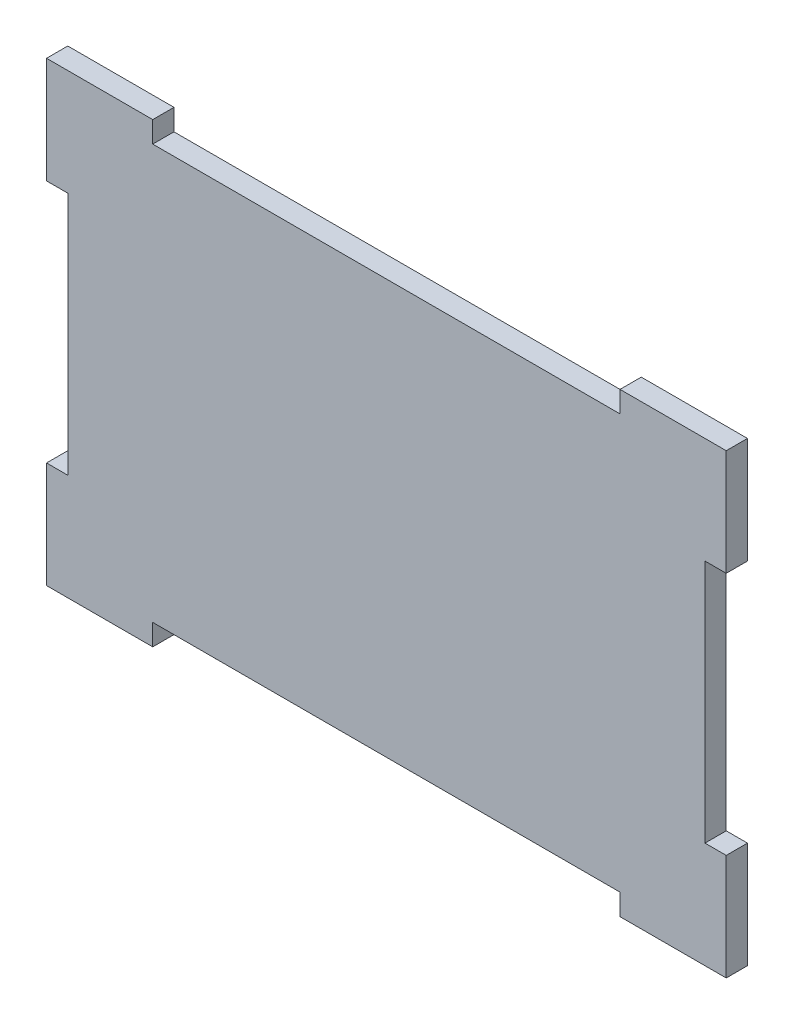
from build123d import *

# Parameters (mm, degrees)
BOSS_EXTRUDE1_DEPTH = 4


with BuildPart() as part:
    # Sketch1 → Boss-Extrude1 (new body)
    with BuildSketch(Plane.XY):
        Polygon((0, 0), (0, 20), (4, 20), (4, 66), (0, 66), (0, 86), (20, 86), (20, 82), (108, 82), (108, 86), (128, 86), (128, 66), (124, 66), (124, 20), (128, 20), (128, 0), (108, 0), (108, 4), (20, 4), (20, 0), align=None)
    extrude(amount=BOSS_EXTRUDE1_DEPTH)


solid = part.part
